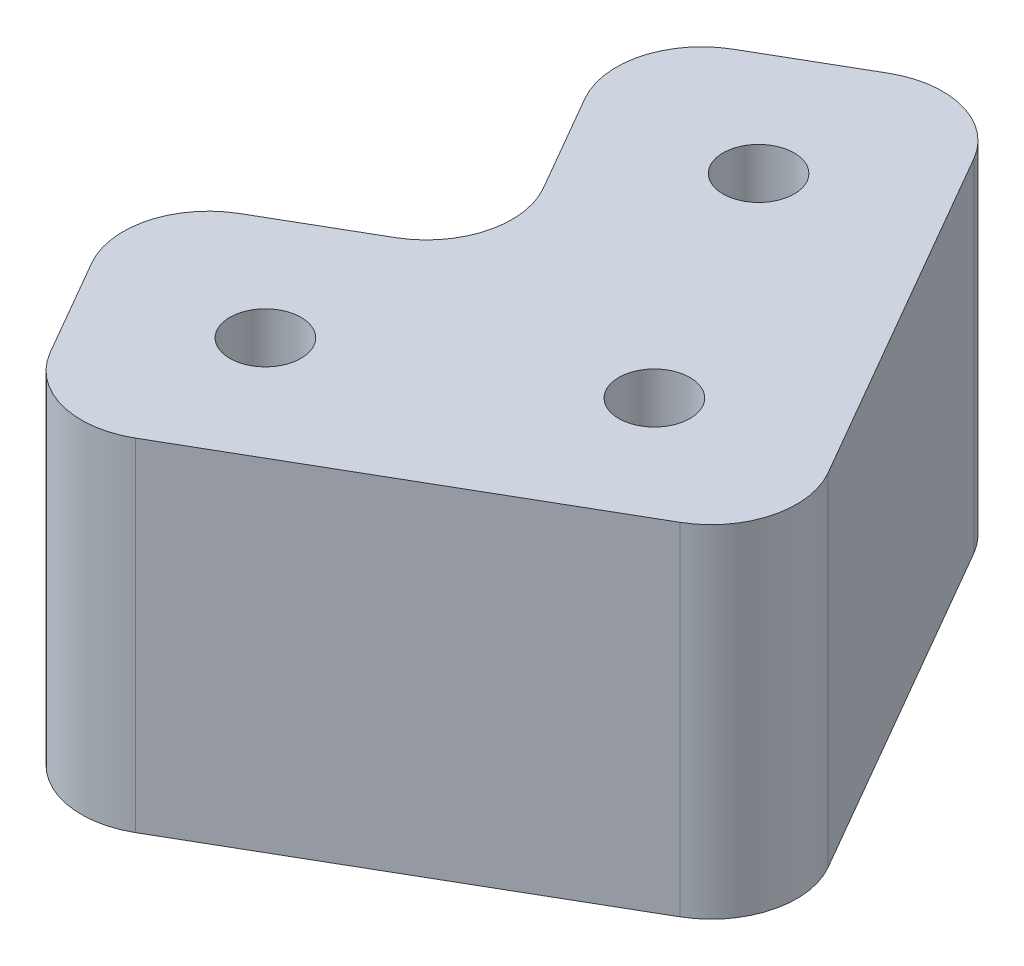
from build123d import *

# Parameters (mm, degrees)
SKETCH_3_R             = 1.25
EXTRUDE_3_DEPTH        = 12
FILLET_1_R             = 3
HOLE_WIZARD_M3_1_D     = 2.5
HOLE_WIZARD_M3_1_DEPTH = 12


with BuildPart() as part:
    # 草图3 → 凸台-拉伸3 (new body)
    with BuildSketch(Plane(origin=(0, 0, 0), x_dir=(1, 0, 0), z_dir=(0, 1, 0))):
        Polygon((-68.791651246, -10.849364905), (-60.131397208, -5.849364905), (-50.131397208, -23.169872981), (-67.451905284, -33.169872981), (-72.451905284, -24.509618943), (-63.791651246, -19.509618943), align=None)
        with Locations(Location((-56.961524227, -21.339745962, 0), (0, 0, 270))):
            Circle(SKETCH_3_R, mode=Mode.SUBTRACT)
        with Locations(Location((-61.961524227, -12.679491924, 0), (0, 0, 270))):
            Circle(SKETCH_3_R, mode=Mode.SUBTRACT)
        with Locations(Location((-65.621778265, -26.339745962, 0), (0, 0, 270))):
            Circle(SKETCH_3_R, mode=Mode.SUBTRACT)
    extrude(amount=EXTRUDE_3_DEPTH)

    # 圆角1
    fillet_1_edges = [part.edges().sort_by_distance(p)[0] for p in [
        (-68.791651246, 6, 10.849364905),
        (-60.131397208, 6, 5.849364905),
        (-50.131397208, 6, 23.169872981),
        (-67.451905284, 6, 33.169872981),
        (-72.451905284, 6, 24.509618943),
        (-63.791651246, 6, 19.509618943),
    ]]
    fillet(fillet_1_edges, radius=FILLET_1_R)

    # M3 螺纹孔1
    with Locations(Plane(origin=(-61.961524227, 12, 12.679491924), x_dir=(0, 0, 1), z_dir=(0, 1, 0))):
        with Locations((0, 0), (8.660254038, 5), (13.660254038, -3.660254038)):
            Hole(HOLE_WIZARD_M3_1_D / 2, depth=HOLE_WIZARD_M3_1_DEPTH)


solid = part.part
